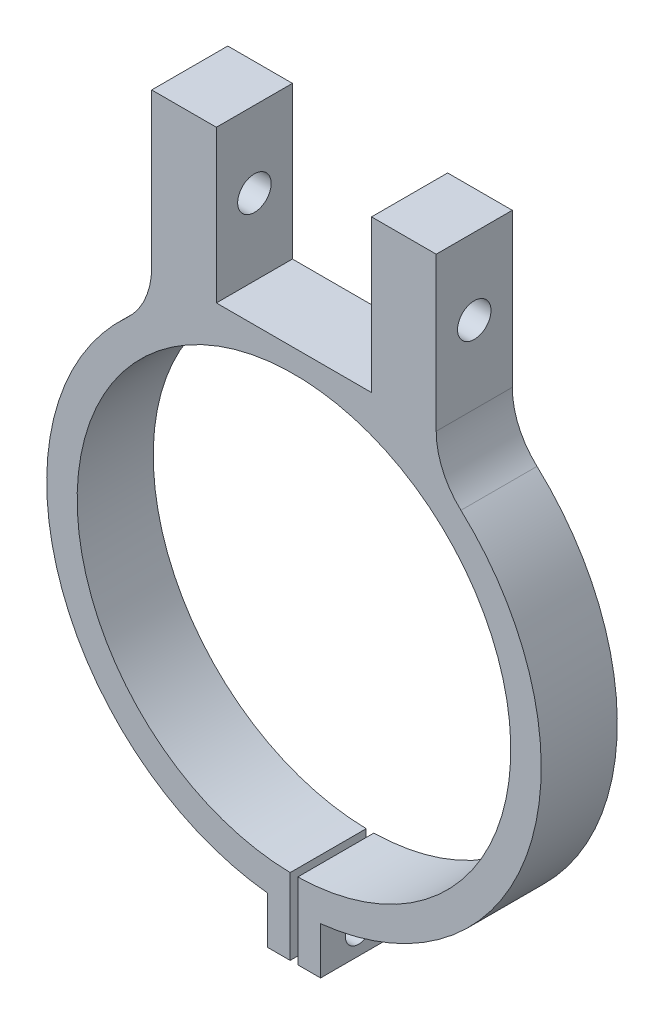
from build123d import *

# Parameters (mm, degrees)
AUFSATZ_LINEAR_AUSTRAGEN1_DEPTH = 10
SKIZZE2_R                       = 1.75
SCHNITT_LINEAR_AUSTRAGEN1_DEPTH = 64.625859523
SKIZZE4_R                       = 2.2
SCHNITT_LINEAR_AUSTRAGEN3_DEPTH = 74.305456823
VERRUNDUNG1_R                   = 10


with BuildPart() as part:
    # Skizze1 → Aufsatz-Linear austragen1 (new body)
    with BuildSketch(Plane.XY):
        with BuildLine():
            Line((0.5, -28.495613698), (0.5, -32.496153619))
            Line((0.5, -32.496153619), (0.5, -38.496153619))
            Line((0.5, -38.496153619), (3.5, -38.496153619))
            Line((3.5, -38.496153619), (3.5, -32.310988843))
            ThreePointArc((3.5, -32.310988843), (31.468752272, -8.122045953), (18.7, 26.581196361))
            Line((18.7, 26.581196361), (18.7, 51.5))
            Line((18.7, 51.5), (10.2, 51.5))
            Line((10.2, 51.5), (10.2, 31.5))
            Line((10.2, 31.5), (-10.2, 31.5))
            Line((-10.2, 31.5), (-10.2, 51.5))
            Line((-10.2, 51.5), (-18.7, 51.5))
            Line((-18.7, 51.5), (-18.7, 26.581196361))
            ThreePointArc((-18.7, 26.581196361), (-31.468752272, -8.122045953), (-3.5, -32.310988843))
            Line((-3.5, -32.310988843), (-3.5, -38.496153619))
            Line((-3.5, -38.496153619), (-0.5, -38.496153619))
            Line((-0.5, -38.496153619), (-0.5, -32.496153619))
            Line((-0.5, -32.496153619), (-0.5, -28.495613698))
            ThreePointArc((-0.5, -28.495613698), (0, 28.5), (0.5, -28.495613698))
        make_face()
    extrude(amount=AUFSATZ_LINEAR_AUSTRAGEN1_DEPTH)

    # Skizze2 → Schnitt-Linear austragen1 (cut, through all)
    with BuildSketch(Plane.ZY.offset(3.5)):
        with Locations((5, -35.403571231)):
            Circle(SKIZZE2_R)
    extrude(amount=-SCHNITT_LINEAR_AUSTRAGEN1_DEPTH, mode=Mode.SUBTRACT)

    # Skizze4 → Schnitt-Linear austragen3 (cut, through all)
    with BuildSketch(Plane.ZY.offset(18.7)):
        with Locations(Location((5, 41.5, 0), (0, 0, 270))):
            Circle(SKIZZE4_R)
    extrude(amount=-SCHNITT_LINEAR_AUSTRAGEN3_DEPTH, mode=Mode.SUBTRACT)

    # Verrundung1
    verrundung1_edges = [part.edges().sort_by_distance(p)[0] for p in [
        (-18.7, 26.581196361, 5),
        (18.7, 26.581196361, 5),
    ]]
    fillet(verrundung1_edges, radius=VERRUNDUNG1_R)


solid = part.part
